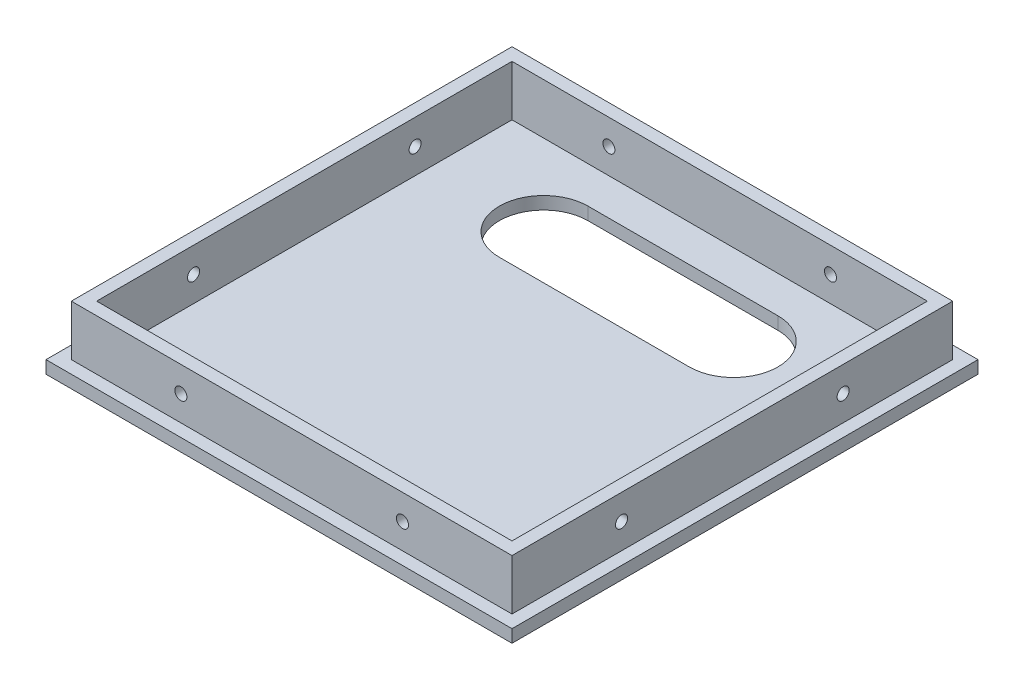
from build123d import *

# Parameters (mm, degrees)
SKETCH_1_W          = 69.6
SKETCH_1_H          = 69.6
SKETCH_1_W_2        = 65.6
SKETCH_1_H_2        = 65.6
EXTRUDE_1_DEPTH     = 8
SKETCH_2_W          = 73.6
SKETCH_2_H          = 73.6
EXTRUDE_2_DEPTH     = 2
SKETCH_3_R          = 0.95
CUT_EXTRUDE_1_DEPTH = 81.899938195
SKETCH_4_R          = 0.95
CUT_EXTRUDE_2_DEPTH = 81.899938195


with BuildPart() as part:
    # 草图1 → 凸台-拉伸1 (new body)
    with BuildSketch(Plane(origin=(0, 0, 0), x_dir=(1, 0, 0), z_dir=(0, 1, 0))):
        Rectangle(SKETCH_1_W, SKETCH_1_H)
        Rectangle(SKETCH_1_W_2, SKETCH_1_H_2, mode=Mode.SUBTRACT)
    extrude(amount=EXTRUDE_1_DEPTH)

    # 草图2 → 凸台-拉伸2 (add)
    with BuildSketch(Plane.XZ):
        Rectangle(SKETCH_2_W, SKETCH_2_H)
        with BuildLine():
            Line((-15, -13), (15, -13))
            ThreePointArc((15, -13), (22, -20), (15, -27))
            Line((15, -27), (-15, -27))
            ThreePointArc((-15, -27), (-22, -20), (-15, -13))
        make_face(mode=Mode.SUBTRACT)
    extrude(amount=EXTRUDE_2_DEPTH)

    # 草图3 → 切除-拉伸1 (cut, through all)
    with BuildSketch(Plane.ZY.offset(34.8)):
        with Locations((17.5, 4)):
            Circle(SKETCH_3_R)
        with Locations((-17.5, 4)):
            Circle(SKETCH_3_R)
    extrude(amount=-CUT_EXTRUDE_1_DEPTH, mode=Mode.SUBTRACT)

    # 草图4 → 切除-拉伸2 (cut, through all)
    with BuildSketch(Plane(origin=(0, 0, -34.8), x_dir=(-1, 0, 0), z_dir=(0, 0, -1))):
        with Locations((17.5, 4)):
            Circle(SKETCH_4_R)
        with Locations((-17.5, 4)):
            Circle(SKETCH_4_R)
    extrude(amount=-CUT_EXTRUDE_2_DEPTH, mode=Mode.SUBTRACT)


solid = part.part
